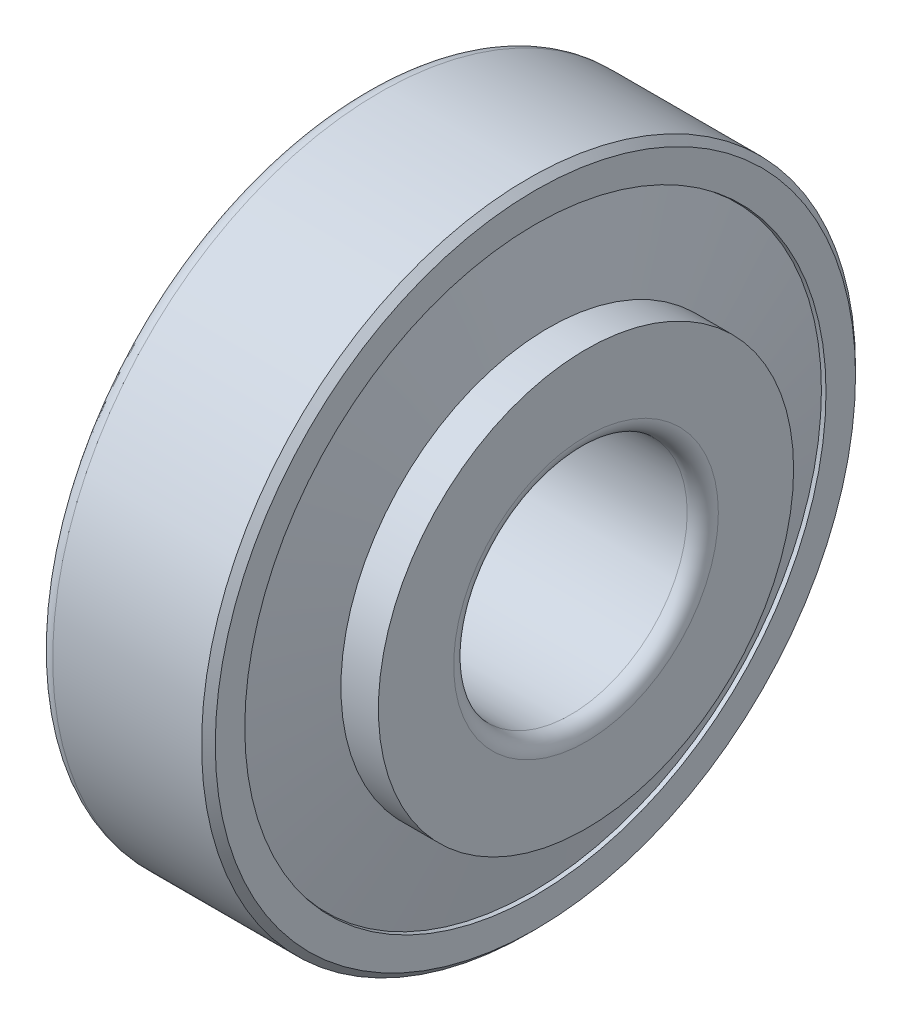
from build123d import *


with BuildPart() as part:
    # OutRacSke → OuterRace (revolve)
    with BuildSketch(Plane.XY):
        with BuildLine():
            Line((-3.25, 18.664802045), (-14.25, 16.636))
            Line((-14.25, 16.636), (-14.25, 20))
            ThreePointArc((-14.25, 20), (-13.957106781, 20.707106781), (-13.25, 21))
            Line((-13.25, 21), (-3.69, 21))
            Line((-3.69, 21), (-3.25, 20.56))
            Line((-3.25, 20.56), (-3.25, 18.664802045))
        make_face()
    revolve(axis=Axis((-42.5, 0, 0), (1, 0, 0)))

    # RolSimSke → RollersSimplified (revolve)
    with BuildSketch(Plane.XY):
        Polygon((-13.25, 16.904538732), (-3.51420572, 18.700175036), (-2.412337988, 12.725937637), (-12.148132268, 10.930301333), align=None)
    revolve(axis=Axis((0, 0, 0), (-1, 0, 0)))

    # InsRacSke → InnerRace (revolve)
    with BuildSketch(Plane.XY):
        with BuildLine():
            Line((-12.198645533, 11.234051333), (-13, 11.234051333))
            Line((-13, 11.234051333), (-13, 7.94))
            Line((-13, 7.94), (-12.56, 7.5))
            Line((-12.56, 7.5), (-1, 7.5))
            ThreePointArc((-1, 7.5), (-0.292893219, 7.792893219), (0, 8.5))
            Line((0, 8.5), (0, 13.333437637))
            Line((0, 13.333437637), (-2.406828651, 13.333437637))
            Line((-2.406828651, 13.333437637), (-2.406828651, 12.725937637))
            Line((-2.406828651, 12.725937637), (-12.142622931, 10.930301333))
            Line((-12.142622931, 10.930301333), (-12.198645533, 11.234051333))
        make_face()
    revolve(axis=Axis((-42.5, 0, 0), (1, 0, 0)))


solid = part.part
